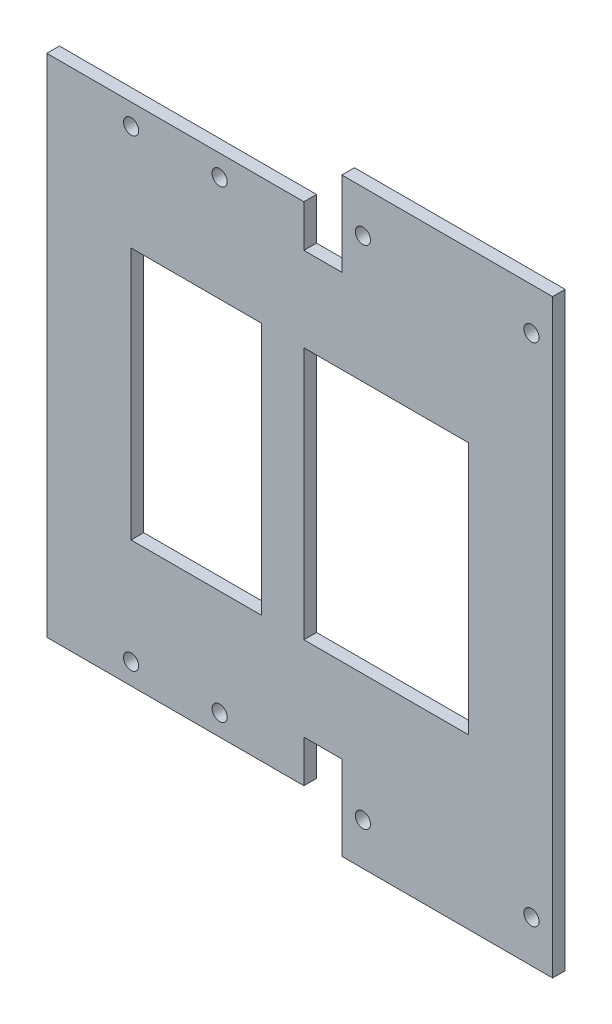
from build123d import *

# Parameters (mm, degrees)
ESQUISSE1_W        = 120
ESQUISSE1_H        = 100
ESQUISSE1_W_2      = 39
ESQUISSE1_H_2      = 60
ESQUISSE1_W_3      = 31
ESQUISSE1_W_4      = 50
ESQUISSE1_H_3      = 20
ESQUISSE1_R        = 1.8
ESQUISSE1_W_5      = 61
ESQUISSE1_H_4      = 10
BOSS_EXTRU_1_DEPTH = 3


with BuildPart() as part:
    # Esquisse1 → Boss.-Extru.1 (new body)
    # profile 1 of 5: a face of its own
    with BuildSketch(Plane.XY):
        with Locations((60, 50)):
            Rectangle(ESQUISSE1_W, ESQUISSE1_H)
        with Locations((80.5, 50)):
            Rectangle(ESQUISSE1_W_2, ESQUISSE1_H_2, mode=Mode.SUBTRACT)
        with Locations((35.5, 50)):
            Rectangle(ESQUISSE1_W_3, ESQUISSE1_H_2, mode=Mode.SUBTRACT)
    # profile 2 of 5: a face of its own
    with BuildSketch(Plane.XY):
        with Locations((95, -10)):
            Rectangle(ESQUISSE1_W_4, ESQUISSE1_H_3)
        with Locations((75, -10)):
            Circle(ESQUISSE1_R, mode=Mode.SUBTRACT)
        with Locations((115, -10)):
            Circle(ESQUISSE1_R, mode=Mode.SUBTRACT)
    # profile 3 of 5: a face of its own
    with BuildSketch(Plane.XY):
        with Locations((30.5, -5)):
            Rectangle(ESQUISSE1_W_5, ESQUISSE1_H_4)
        with Locations((20, -5)):
            Circle(ESQUISSE1_R, mode=Mode.SUBTRACT)
        with Locations((41, -5)):
            Circle(ESQUISSE1_R, mode=Mode.SUBTRACT)
    # profile 4 of 5: a face of its own
    with BuildSketch(Plane.XY):
        with Locations((30.5, 105)):
            Rectangle(ESQUISSE1_W_5, ESQUISSE1_H_4)
        with Locations((20, 105)):
            Circle(ESQUISSE1_R, mode=Mode.SUBTRACT)
        with Locations((41, 105)):
            Circle(ESQUISSE1_R, mode=Mode.SUBTRACT)
    # profile 5 of 5: a face of its own
    with BuildSketch(Plane.XY):
        with Locations((95, 110)):
            Rectangle(ESQUISSE1_W_4, ESQUISSE1_H_3)
        with Locations((75, 110)):
            Circle(ESQUISSE1_R, mode=Mode.SUBTRACT)
        with Locations((115, 110)):
            Circle(ESQUISSE1_R, mode=Mode.SUBTRACT)
    extrude(amount=BOSS_EXTRU_1_DEPTH)


solid = part.part
